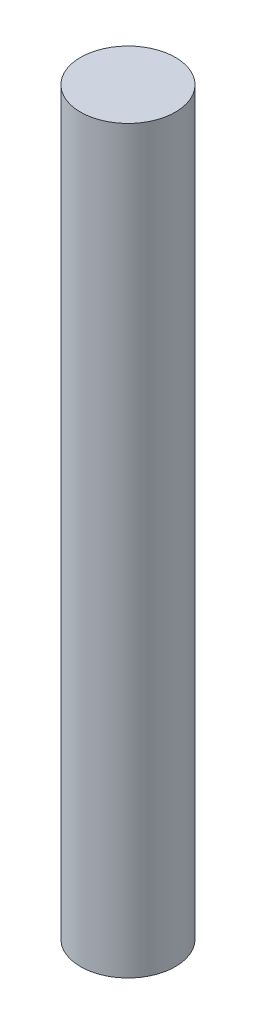
from build123d import *

# Parameters (mm, degrees)
SKETCH1_R           = 1.5875
BOSS_EXTRUDE1_DEPTH = 24.765


with BuildPart() as part:
    # Sketch1 → Boss-Extrude1 (new body)
    with BuildSketch(Plane(origin=(0, 0, 0), x_dir=(1, 0, 0), z_dir=(0, 1, 0))):
        with Locations(Location((0, 0, 0), (0, 0, 270))):
            Circle(SKETCH1_R)
    extrude(amount=BOSS_EXTRUDE1_DEPTH)


solid = part.part
